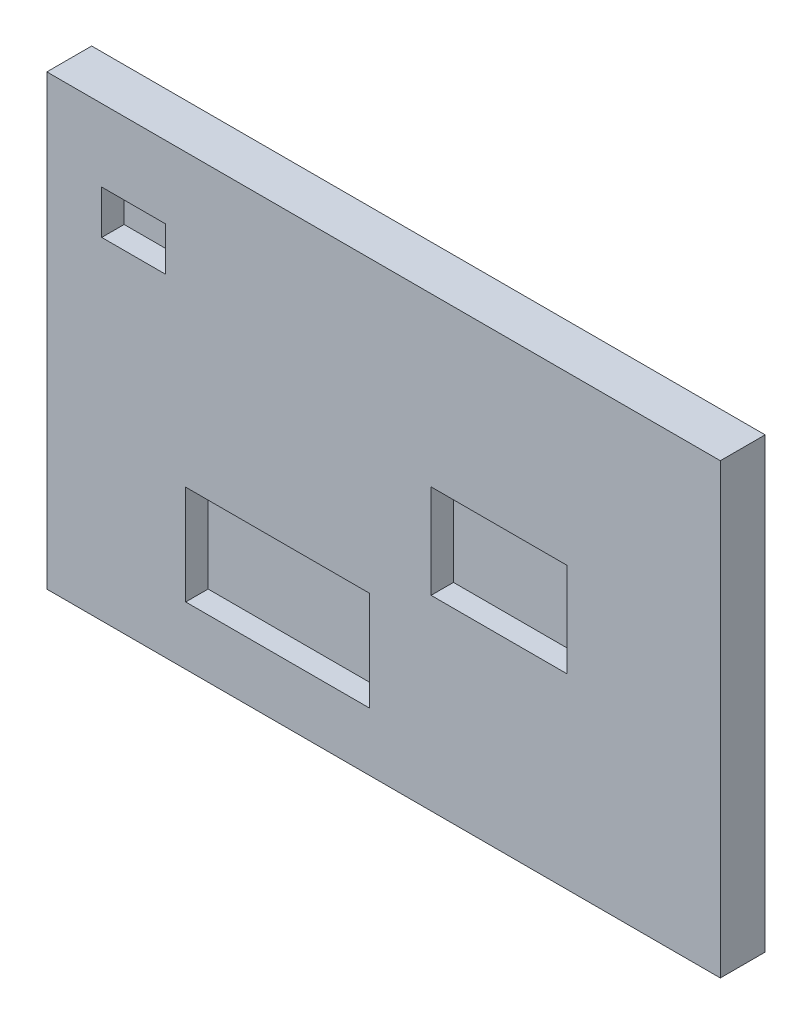
from build123d import *

# Parameters (mm, degrees)
SKETCH1_W           = 150.33165829
SKETCH1_H           = 100
BOSS_EXTRUDE1_DEPTH = 10
SKETCH2_W           = 14.278709015
SKETCH2_H           = 9.735554689
SKETCH2_W_2         = 30.342256657
SKETCH2_H_2         = 20.971853865
SKETCH2_W_3         = 41.051288419
SKETCH2_H_3         = 22.198930422
CUT_EXTRUDE1_DEPTH  = 5


with BuildPart() as part:
    # Sketch1 → Boss-Extrude1 (new body)
    with BuildSketch(Plane.XY):
        with Locations((30.442211055, -24.120603015)):
            Rectangle(SKETCH1_W, SKETCH1_H)
    extrude(amount=BOSS_EXTRUDE1_DEPTH)

    # Sketch2 → Cut-Extrude1 (cut)
    with BuildSketch(Plane.XY.offset(10)):
        with Locations((-25.333996036, 4.867777345)):
            Rectangle(SKETCH2_W, SKETCH2_H)
        with Locations((56.210818731, -21.945330938)):
            Rectangle(SKETCH2_W_2, SKETCH2_H_2)
        with Locations((6.793099248, -50.000763105)):
            Rectangle(SKETCH2_W_3, SKETCH2_H_3)
    extrude(amount=-CUT_EXTRUDE1_DEPTH, mode=Mode.SUBTRACT)


solid = part.part
